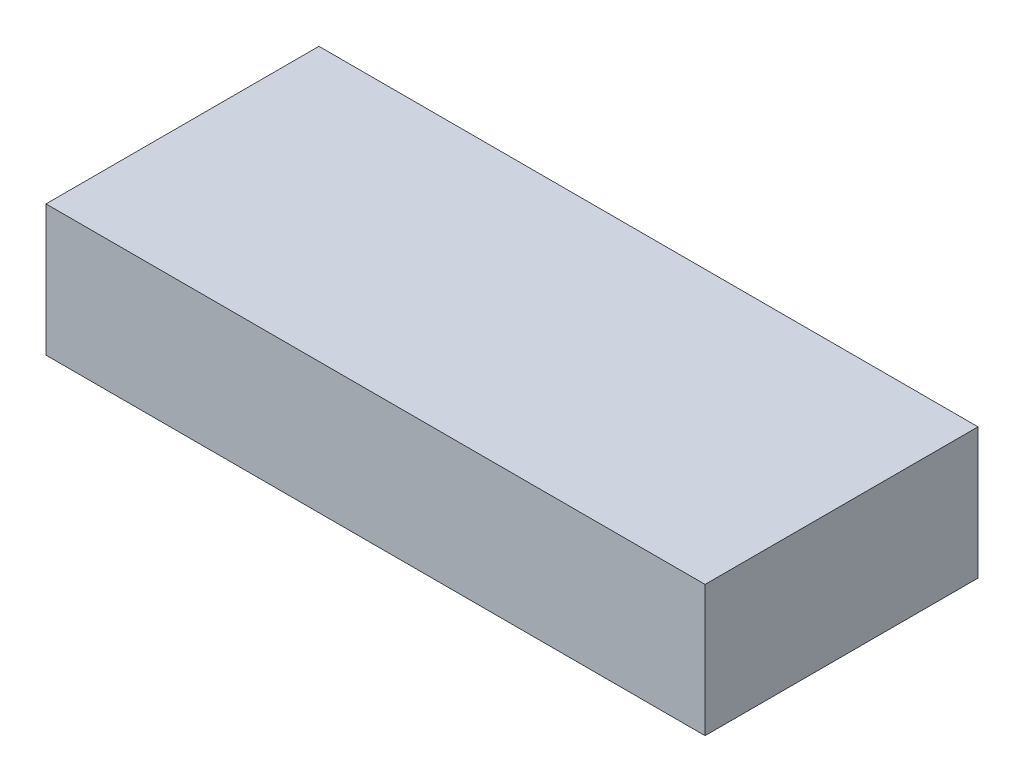
from build123d import *

# Parameters (mm, degrees)
SKETCH1_W      = 50.3
SKETCH1_H      = 10
ENVELOPE_DEPTH = 20.83


with BuildPart() as part:
    # Sketch1 → Envelope (new body)
    with BuildSketch(Plane.XY):
        Rectangle(SKETCH1_W, SKETCH1_H)
    extrude(amount=ENVELOPE_DEPTH)


solid = part.part
